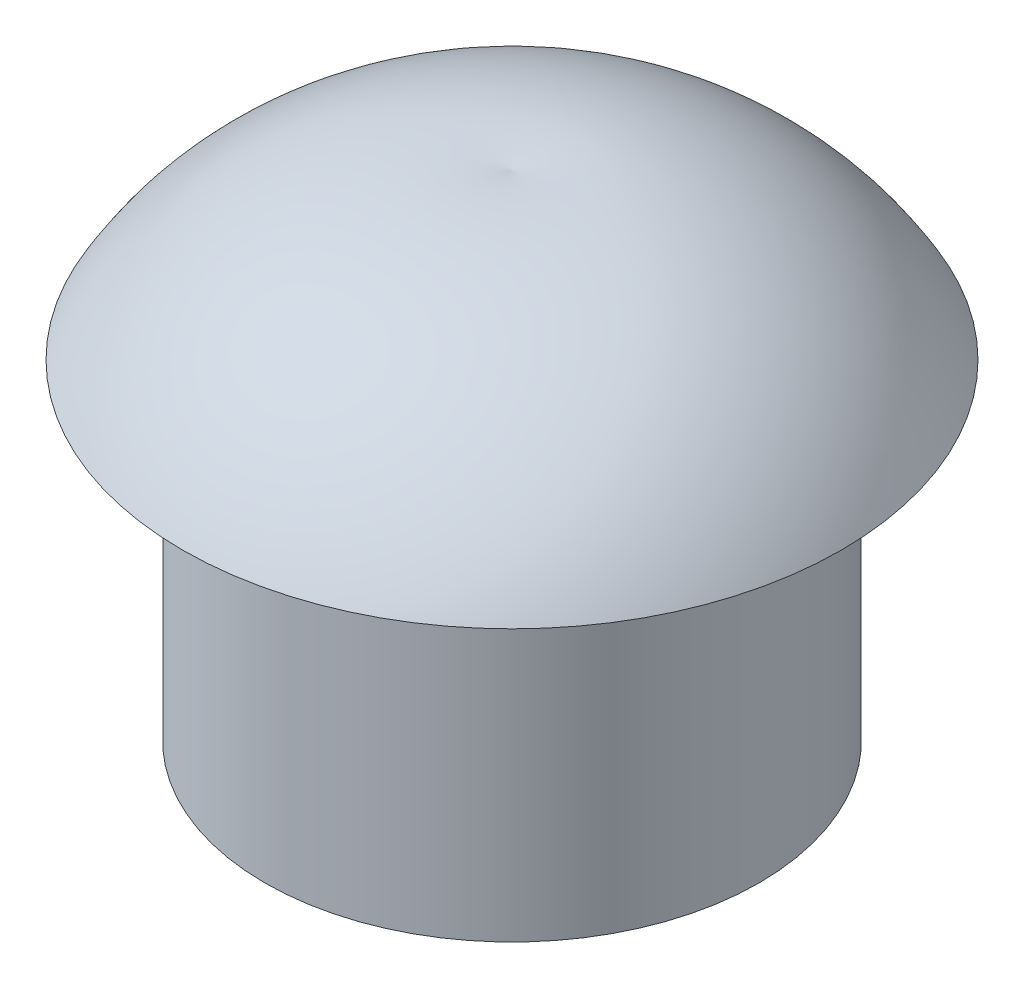
from build123d import *

# Parameters (mm, degrees)
SKETCH1_R           = 1.5
BOSS_EXTRUDE1_DEPTH = 2


with BuildPart() as part:
    # Sketch1 → Boss-Extrude1 (new body)
    with BuildSketch(Plane(origin=(0, 0, 0), x_dir=(1, 0, 0), z_dir=(0, 1, 0))):
        with Locations(Location((0, 0, 0), (0, 0, 270))):
            Circle(SKETCH1_R)
    extrude(amount=-BOSS_EXTRUDE1_DEPTH)

    # Sketch3 → Revolve1 (revolve)
    with BuildSketch(Plane.XY):
        with BuildLine():
            Line((0, 0), (2, 0))
            ThreePointArc((2, 0), (1.152807342, 0.805614685), (0, 1))
            Line((0, 1), (0, 0))
        make_face()
    revolve(axis=Axis((0, 0, 0), (0, 1, 0)))


solid = part.part
